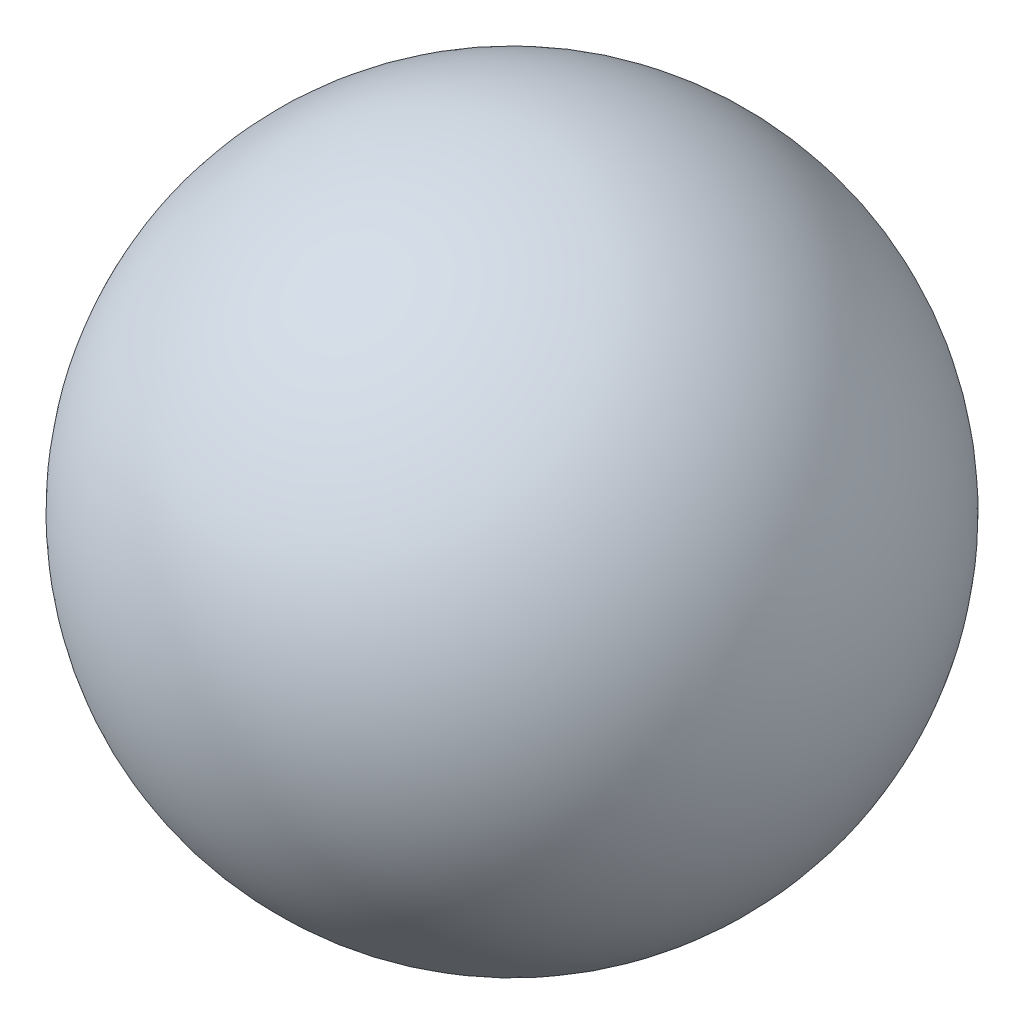
from build123d import *


with BuildPart() as part:
    # Sketch1 → Revolve1 (revolve)
    with BuildSketch(Plane(origin=(0, 0, 0), x_dir=(1, 0, 0), z_dir=(0, 1, 0))):
        with BuildLine():
            Line((-50.8, 0), (50.8, 0))
            ThreePointArc((50.8, 0), (0, 50.8), (-50.8, 0))
        make_face()
    revolve(axis=Axis((-50.8, 0, 0), (1, 0, 0)))


solid = part.part
